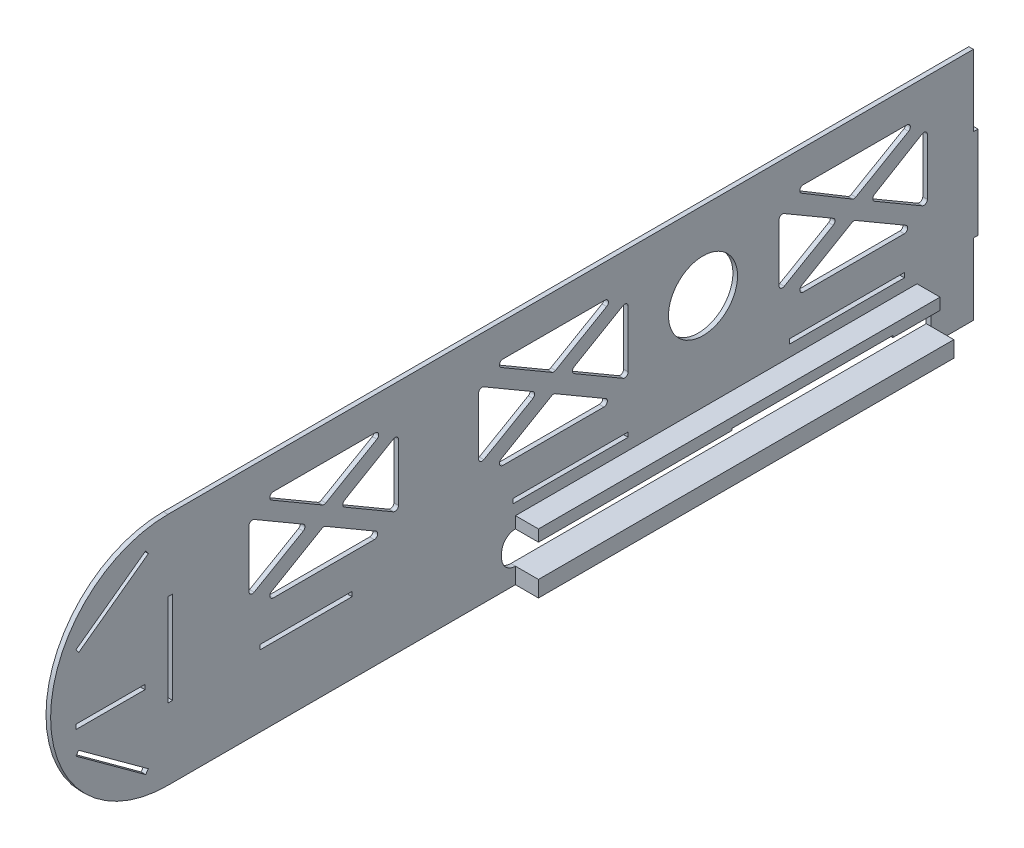
from build123d import *

# Parameters (mm, degrees)
SKETCH_1_W      = 40
SKETCH_1_H      = 2
SKETCH_1_W_2    = 50
SKETCH_1_R      = 15
SKETCH_1_W_3    = 30
SKETCH_1_W_4    = 2
SKETCH_1_H_2    = 40
EXTRUDE_3_DEPTH = 2
SKETCH_2_W      = 180.5
SKETCH_2_H      = 7
EXTRUDE_4_DEPTH = 10


with BuildPart() as part:
    # 草图1 → 凸台-拉伸3 (new body)
    # profile 1 of 4: a face of its own
    with BuildSketch(Plane(origin=(0, 0, 0), x_dir=(0, 0, -1), z_dir=(1, 0, 0))):
        Polygon((139, 51), (0, 51), (0, 20), (2, 20), (2, -20), (0, -20), (0, -51), (350, -51), (350, -20), (350, 20), (350, 51), (337.5, 51), (331.5, 51), (145, 51), align=None)
        with Locations((59.999999544, -18.999999639)):
            Rectangle(SKETCH_1_W, SKETCH_1_H, mode=Mode.SUBTRACT)
        with BuildLine():
            Line((145, -38), (145, -36))
            ThreePointArc((145, -36), (146.757359313, -31.757359313), (151, -30))
            Line((151, -30), (235, -30))
            Line((235, -30), (235, -29.2))
            Line((235, -29.2), (305, -29.2))
            Line((305, -29.2), (305, -30))
            Line((305, -30), (325.5, -30))
            ThreePointArc((325.5, -30), (329.742640687, -31.757359313), (331.5, -36))
            Line((331.5, -36), (331.5, -39))
            Line((331.5, -39), (331.5, -44))
            Line((331.5, -44), (325.5, -44))
            Line((325.5, -44), (151, -44))
            ThreePointArc((151, -44), (146.757359313, -42.242640687), (145, -38))
        make_face(mode=Mode.SUBTRACT)
        with Locations((174.999999544, -18.999999639)):
            Rectangle(SKETCH_1_W_2, SKETCH_1_H, mode=Mode.SUBTRACT)
        with Locations((294.999999544, -18.999999639)):
            Rectangle(SKETCH_1_W_2, SKETCH_1_H, mode=Mode.SUBTRACT)
        with BuildLine():
            Line((35.191745107, 4.260800891), (35.191745107, 29.047933032))
            ThreePointArc((35.191745107, 29.047933032), (35.944654017, 30.348646261), (37.447551645, 30.343601384))
            Line((37.447551645, 30.343601384), (58.776761499, 17.901562302))
            ThreePointArc((58.776761499, 17.901562302), (59.520952796, 16.603345479), (58.772354511, 15.307664881))
            Line((58.772354511, 15.307664881), (37.443144656, 2.962571821))
            ThreePointArc((37.443144656, 2.962571821), (35.942445208, 2.961358833), (35.191745107, 4.260800891))
        make_face(mode=Mode.SUBTRACT)
        with BuildLine():
            Line((89.643364252, -3.340511469), (45.740125962, -3.340511469))
            ThreePointArc((45.740125962, -3.340511469), (44.292109641, -2.231981438), (44.984319423, -0.544843118))
            Line((44.984319423, -0.544843118), (66.935938568, 12.26026805))
            ThreePointArc((66.935938568, 12.26026805), (67.691745107, 12.464599699), (68.447551645, 12.26026805))
            Line((68.447551645, 12.26026805), (90.39917079, -0.544843118))
            ThreePointArc((90.39917079, -0.544843118), (91.091380572, -2.231981438), (89.643364252, -3.340511469))
        make_face(mode=Mode.SUBTRACT)
        with BuildLine():
            ThreePointArc((97.935938568, 30.343601384), (99.438836196, 30.348646261), (100.191745107, 29.047933032))
            Line((100.191745107, 29.047933032), (100.191745107, 4.27104403))
            ThreePointArc((100.191745107, 4.27104403), (99.438836196, 2.970330801), (97.935938568, 2.975375678))
            Line((97.935938568, 2.975375678), (76.698605138, 15.36382018))
            ThreePointArc((76.698605138, 15.36382018), (75.954411676, 16.659488531), (76.698605138, 17.955156882))
            Line((76.698605138, 17.955156882), (97.935938568, 30.343601384))
        make_face(mode=Mode.SUBTRACT)
        with BuildLine():
            Line((134.999999544, 4.260800891), (134.999999544, 29.047933032))
            ThreePointArc((134.999999544, 29.047933032), (135.752908454, 30.348646261), (137.255806082, 30.343601384))
            Line((137.255806082, 30.343601384), (158.585015936, 17.901562302))
            ThreePointArc((158.585015936, 17.901562302), (159.329207233, 16.603345479), (158.580608948, 15.307664881))
            Line((158.580608948, 15.307664881), (137.251399093, 2.962571821))
            ThreePointArc((137.251399093, 2.962571821), (135.750699645, 2.961358833), (134.999999544, 4.260800891))
        make_face(mode=Mode.SUBTRACT)
        with BuildLine():
            ThreePointArc((44.984319423, 33.86382018), (44.292109641, 35.5509585), (45.740125962, 36.659488531))
            Line((45.740125962, 36.659488531), (90.076890905, 36.659488531))
            ThreePointArc((90.076890905, 36.659488531), (91.525570236, 35.548497783), (90.828290455, 33.861259462))
            Line((90.828290455, 33.861259462), (68.573204266, 20.980280188))
            ThreePointArc((68.573204266, 20.980280188), (67.819256245, 20.778511422), (67.065998178, 20.982840906))
            Line((67.065998178, 20.982840906), (44.984319423, 33.86382018))
        make_face(mode=Mode.SUBTRACT)
        with BuildLine():
            Line((189.451618689, -3.340511469), (145.548380399, -3.340511469))
            ThreePointArc((145.548380399, -3.340511469), (144.100364078, -2.231981438), (144.79257386, -0.544843118))
            Line((144.79257386, -0.544843118), (166.744193005, 12.26026805))
            ThreePointArc((166.744193005, 12.26026805), (167.499999544, 12.464599699), (168.255806082, 12.26026805))
            Line((168.255806082, 12.26026805), (190.207425227, -0.544843118))
            ThreePointArc((190.207425227, -0.544843118), (190.899635009, -2.231981438), (189.451618689, -3.340511469))
        make_face(mode=Mode.SUBTRACT)
        with BuildLine():
            ThreePointArc((197.744193005, 30.684113214), (199.247090633, 30.689158091), (199.999999544, 29.388444862))
            Line((199.999999544, 29.388444862), (199.999999544, 4.61155586))
            ThreePointArc((199.999999544, 4.61155586), (199.247090633, 3.310842631), (197.744193005, 3.315887508))
            Line((197.744193005, 3.315887508), (176.506859575, 15.70433201))
            ThreePointArc((176.506859575, 15.70433201), (175.762666113, 17.000000361), (176.506859575, 18.295668712))
            Line((176.506859575, 18.295668712), (197.744193005, 30.684113214))
        make_face(mode=Mode.SUBTRACT)
        with Locations((232.499999544, 17.000000361)):
            Circle(SKETCH_1_R, mode=Mode.SUBTRACT)
        with BuildLine():
            Line((319.974166341, -3.394327578), (276.070928051, -3.394327578))
            ThreePointArc((276.070928051, -3.394327578), (274.622911731, -2.285797546), (275.315121513, -0.598659226))
            Line((275.315121513, -0.598659226), (297.266740658, 12.206451942))
            ThreePointArc((297.266740658, 12.206451942), (298.022547196, 12.41078359), (298.778353734, 12.206451942))
            Line((298.778353734, 12.206451942), (320.729972879, -0.598659226))
            ThreePointArc((320.729972879, -0.598659226), (321.422182661, -2.285797546), (319.974166341, -3.394327578))
        make_face(mode=Mode.SUBTRACT)
        with BuildLine():
            Line((265.522547196, 4.206984782), (265.522547196, 28.994116924))
            ThreePointArc((265.522547196, 28.994116924), (266.275456106, 30.294830153), (267.778353734, 30.289785275))
            Line((267.778353734, 30.289785275), (289.107563589, 17.847746193))
            ThreePointArc((289.107563589, 17.847746193), (289.851754885, 16.549529371), (289.1031566, 15.253848773))
            Line((289.1031566, 15.253848773), (267.773946745, 2.908755713))
            ThreePointArc((267.773946745, 2.908755713), (266.273247297, 2.907542724), (265.522547196, 4.206984782))
        make_face(mode=Mode.SUBTRACT)
        with BuildLine():
            ThreePointArc((327.730104048, 30.281463391), (329.239984934, 30.298885724), (329.999999544, 28.994116924))
            Line((329.999999544, 28.994116924), (329.999999544, 4.522047385))
            ThreePointArc((329.999999544, 4.522047385), (329.247090633, 3.221334156), (327.744193005, 3.226379034))
            Line((327.744193005, 3.226379034), (307.029407227, 15.310004071))
            ThreePointArc((307.029407227, 15.310004071), (306.285236078, 16.597490851), (307.01531827, 17.893018889))
            Line((307.01531827, 17.893018889), (327.730104048, 30.281463391))
        make_face(mode=Mode.SUBTRACT)
        with BuildLine():
            ThreePointArc((144.79257386, 33.86382018), (144.100364078, 35.5509585), (145.548380399, 36.659488531))
            Line((145.548380399, 36.659488531), (189.885145343, 36.659488531))
            ThreePointArc((189.885145343, 36.659488531), (191.333824673, 35.548497783), (190.636544892, 33.861259462))
            Line((190.636544892, 33.861259462), (168.381458703, 20.980280188))
            ThreePointArc((168.381458703, 20.980280188), (167.627510682, 20.778511422), (166.874252615, 20.982840906))
            Line((166.874252615, 20.982840906), (144.79257386, 33.86382018))
        make_face(mode=Mode.SUBTRACT)
        with BuildLine():
            ThreePointArc((275.298058871, 34.214436971), (274.625531032, 35.901033349), (276.070928051, 37.000000361))
            Line((276.070928051, 37.000000361), (321.088992302, 37.000000361))
            ThreePointArc((321.088992302, 37.000000361), (322.537671633, 35.889009613), (321.840391852, 34.201771291))
            Line((321.840391852, 34.201771291), (298.904006355, 20.926464079))
            ThreePointArc((298.904006355, 20.926464079), (298.140143214, 20.72474493), (297.379737626, 20.939129758))
            Line((297.379737626, 20.939129758), (275.298058871, 34.214436971))
        make_face(mode=Mode.SUBTRACT)
    # profile 2 of 4: a face of its own
    with BuildSketch(Plane(origin=(0, 0, 0), x_dir=(0, 0, -1), z_dir=(1, 0, 0))):
        with BuildLine():
            Line((0, 20), (0, 51))
            ThreePointArc((0, 51), (-36.062445841, 36.062445841), (-51, 0))
            Line((-51, 0), (0, 0))
            Line((0, 0), (0, 20))
        make_face()
        Polygon((-38.821768829, 18.383902445), (-40, 20), (-9.698170842, 42.091834457), (-8.519939671, 40.475736902), align=None, mode=Mode.SUBTRACT)
    # profile 3 of 4: a face of its own
    with BuildSketch(Plane(origin=(0, 0, 0), x_dir=(0, 0, -1), z_dir=(1, 0, 0))):
        with BuildLine():
            Line((0, 0), (-51, 0))
            ThreePointArc((-51, 0), (-36.062445841, -36.062445841), (0, -51))
            Line((0, -51), (0, -20))
            Line((0, -20), (0, 0))
        make_face()
        Polygon((-40, -20), (-38.821768829, -18.383902445), (-8.519939671, -40.475736902), (-9.698170842, -42.091834457), align=None, mode=Mode.SUBTRACT)
        with Locations((-25, -9)):
            Rectangle(SKETCH_1_W_3, SKETCH_1_H, mode=Mode.SUBTRACT)
    # profile 4 of 4: a face of its own
    with BuildSketch(Plane(origin=(0, 0, 0), x_dir=(0, 0, -1), z_dir=(1, 0, 0))):
        with Locations((351, 0)):
            Rectangle(SKETCH_1_W_4, SKETCH_1_H_2)
    extrude(amount=EXTRUDE_3_DEPTH)

    # 草图2 → 凸台-拉伸4 (add)
    with BuildSketch(Plane(origin=(2, 0, 0), x_dir=(0, 0, -1), z_dir=(1, 0, 0))):
        with Locations((241.25, -47.5)):
            Rectangle(SKETCH_2_W, SKETCH_2_H)
        Polygon((151, -30), (235, -30), (235, -29.2), (305, -29.2), (305, -30), (325.5, -30), (325.5, -25), (151, -25), align=None)
    extrude(amount=EXTRUDE_4_DEPTH)


solid = part.part
